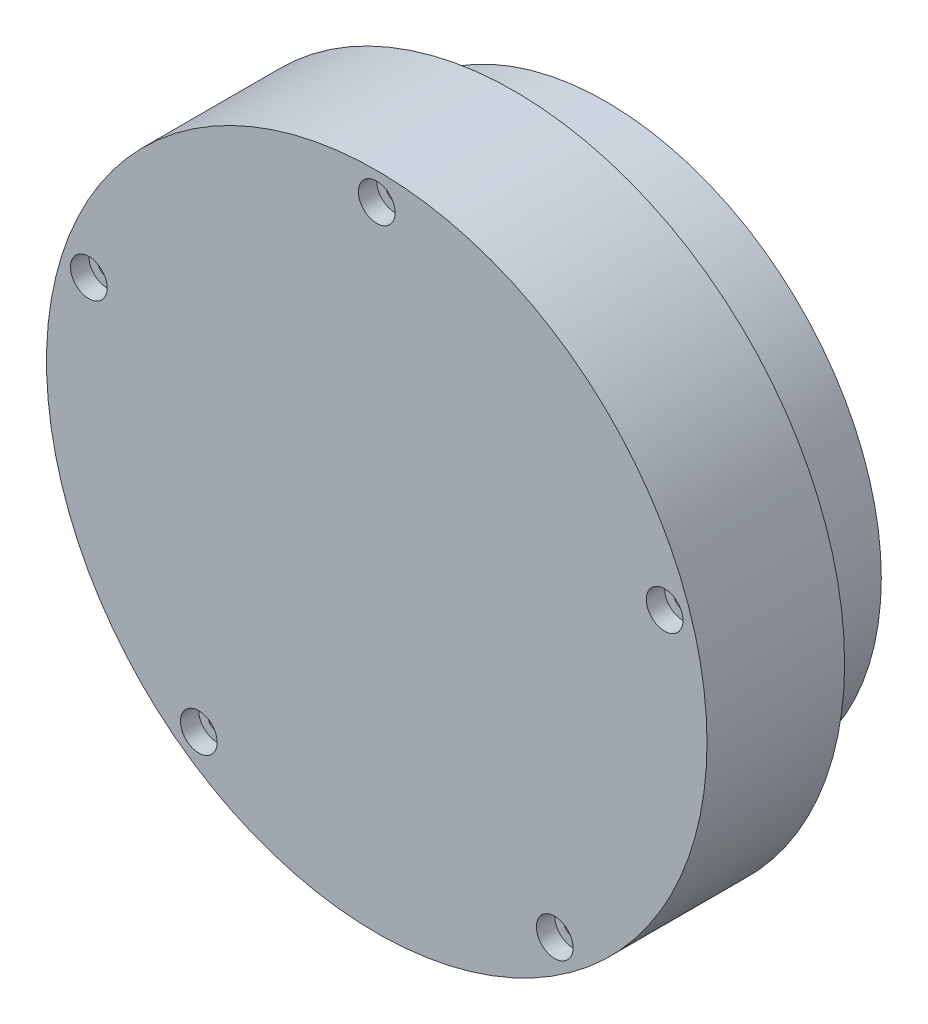
from build123d import *

# Parameters (mm, degrees)
SKETCH2_R          = 1.27
CUT_EXTRUDE1_DEPTH = 27.94
SKETCH3_R          = 2.54
CUT_EXTRUDE5_DEPTH = 2.54
CIRPATTERN1_COUNT  = 5


with BuildPart() as part:
    # Sketch1 → Revolve1 (revolve)
    with BuildSketch(Plane.YZ, mode=Mode.PRIVATE) as revolve1_sk:
        Polygon((0, 33.880456026), (-45.72, 33.880456026), (-45.72, 14.830456026), (-38.1, 14.830456026), (-38.1, 2.130456026), (0, 2.130456026), align=None)
    revolve(revolve1_sk.sketch.rotate(Axis((0, 0, 48.959120521), (0, 0, -1)), 270), axis=Axis((0, 0, 48.959120521), (0, 0, -1)))

    # Sketch2 → Cut-Extrude1 (cut)
    with BuildSketch(Plane.XY.offset(33.880456026)):
        with Locations((0, 41.91)):
            Circle(SKETCH2_R)
    cut_extrude1 = extrude(amount=-CUT_EXTRUDE1_DEPTH, mode=Mode.SUBTRACT)

    # Sketch3 → Cut-Extrude5 (cut)
    with BuildSketch(Plane.XY.offset(33.880456026)):
        with Locations((0, 41.91)):
            Circle(SKETCH3_R)
    cut_extrude5 = extrude(amount=-CUT_EXTRUDE5_DEPTH, mode=Mode.SUBTRACT)

    # CirPattern1: Cut-Extrude1, Cut-Extrude5 ×5 about axis
    cirpattern1_axis = Axis((0, 0, 0), (0, 0, 1))
    add([cut_extrude1.rotate(cirpattern1_axis, i * 360 / CIRPATTERN1_COUNT) for i in range(1, CIRPATTERN1_COUNT)], mode=Mode.SUBTRACT)
    add([cut_extrude5.rotate(cirpattern1_axis, i * 360 / CIRPATTERN1_COUNT) for i in range(1, CIRPATTERN1_COUNT)], mode=Mode.SUBTRACT)


solid = part.part
